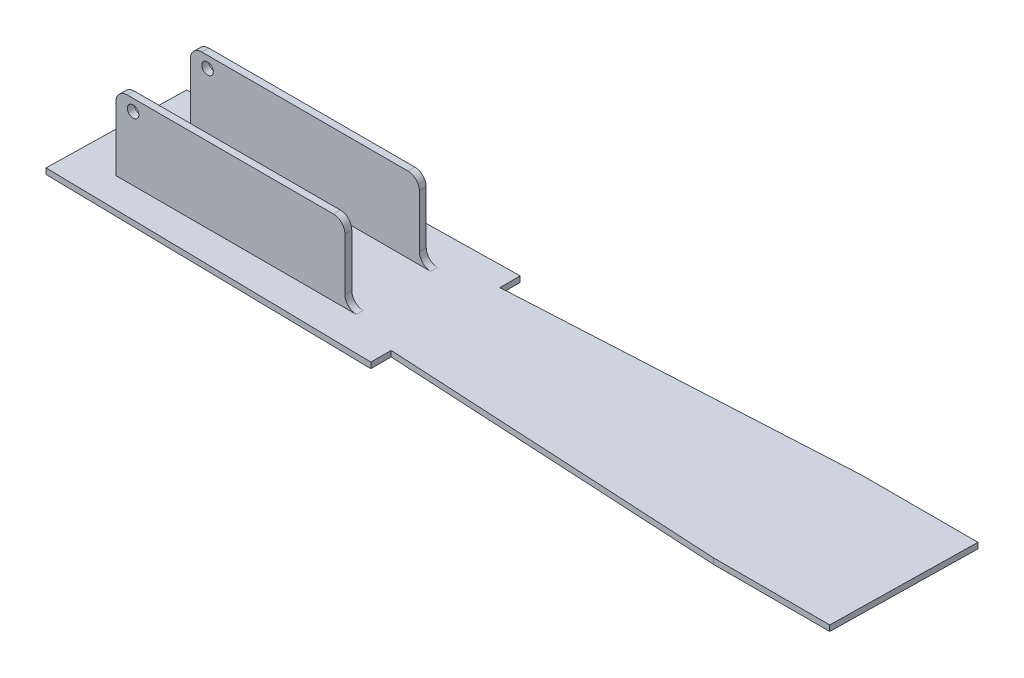
from build123d import *

# Parameters (mm, degrees)
BOSS_EXTRUDE1_DEPTH = 1.27
SKETCH5_W           = 50.8
SKETCH5_H           = 1.524
BOSS_EXTRUDE2_DEPTH = 16.764
SKETCH6_R           = 1.27
CUT_EXTRUDE1_DEPTH  = 19.304
FILLET1_R           = 2.54
SKETCH7_R           = 1.27
CUT_EXTRUDE2_DEPTH  = 19.304


with BuildPart() as part:
    # Sketch4 → Boss-Extrude1 (new body)
    with BuildSketch(Plane(origin=(0, 0, 0), x_dir=(1, 0, 0), z_dir=(0, 1, 0))):
        Polygon((87.667304241, 16.16075), (87.093635827, -16.16075), (61.31636847, -16.16075), (-14.309963117, -12.065), (-14.309963117, -16.570075948), (-87.667304241, -15.289618795), (-87.036695722, 15.300626108), (-14.309963117, 16.570075948), (-14.309963117, 12.065), (61.890036883, 16.16075), align=None)
    extrude(amount=BOSS_EXTRUDE1_DEPTH)

    # Sketch5 → Boss-Extrude2 (add)
    with BuildSketch(Plane(origin=(0, 1.27, 0), x_dir=(1, 0, 0), z_dir=(0, 1, 0))):
        with Locations((-53.018825687, -8.260503656)):
            Rectangle(SKETCH5_W, SKETCH5_H)
        with Locations((-53.018825687, 8.260503656)):
            Rectangle(SKETCH5_W, SKETCH5_H)
    extrude(amount=BOSS_EXTRUDE2_DEPTH)

    # Sketch6 → Cut-Extrude1 (cut)
    with BuildSketch(Plane.XY.offset(9.022503656)):
        with Locations((-74.608825687, 15.494)):
            Circle(SKETCH6_R)
    extrude(amount=-CUT_EXTRUDE1_DEPTH, mode=Mode.SUBTRACT)

    # Fillet1
    fillet1_edges = [part.edges().sort_by_distance(p)[0] for p in [
        (-27.618825687, 1.27, -8.260503656),
        (-27.618825687, 18.034, -8.260503656),
        (-78.418825687, 18.034, -8.260503656),
        (-27.618825687, 1.27, 8.260503656),
        (-78.418825687, 18.034, 8.260503656),
        (-27.618825687, 18.034, 8.260503656),
    ]]
    fillet(fillet1_edges, radius=FILLET1_R)

    # Sketch7 → Cut-Extrude2 (cut)
    with BuildSketch(Plane(origin=(0, 1.27, 0), x_dir=(1, 0, 0), z_dir=(0, 1, 0))):
        with Locations(Location((-58.141999981, 0.005503656, 0), (0, 0, 270))):
            Circle(SKETCH7_R)
    extrude(amount=-CUT_EXTRUDE2_DEPTH, mode=Mode.SUBTRACT)


solid = part.part
